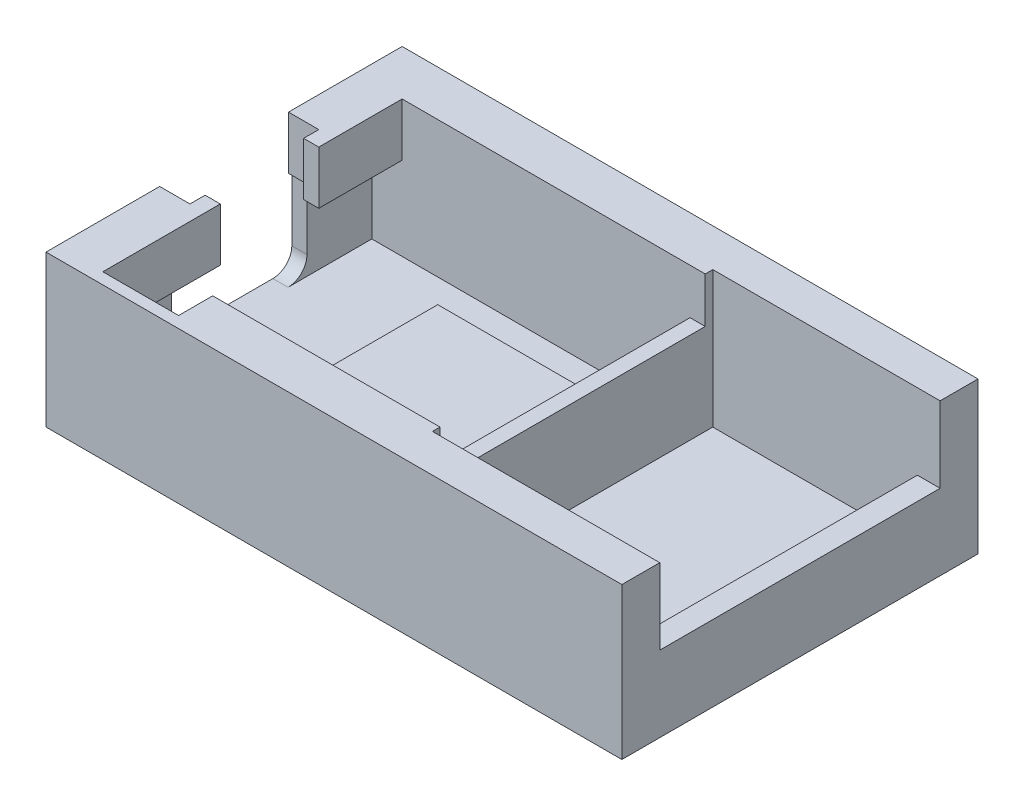
from build123d import *

# Parameters (mm, degrees)
SKETCH1_W           = 40
SKETCH1_H           = 24
BOSS_EXTRUDE1_DEPTH = 1
SKETCH2_W           = 40
SKETCH2_H           = 24
SKETCH2_W_2         = 21
SKETCH2_H_2         = 17.5
SKETCH2_W_3         = 13
SKETCH2_H_3         = 18.5
BOSS_EXTRUDE3_DEPTH = 9
SKETCH3_W           = 1
SKETCH3_H           = 17.5
CUT_EXTRUDE2_DEPTH  = 3
SKETCH4_W           = 10.24
SKETCH4_H           = 11.92
BOSS_EXTRUDE4_DEPTH = 1.21
CUT_EXTRUDE3_DEPTH  = 2
SKETCH8_W           = 4
SKETCH8_H           = 18.5
CUT_EXTRUDE4_DEPTH  = 5
SKETCH11_W          = 24
SKETCH11_H          = 10
CUT_EXTRUDE5_DEPTH  = 2
SKETCH12_W          = 4
SKETCH12_H          = 3
CUT_EXTRUDE6_DEPTH  = 3
BOSS_EXTRUDE5_DEPTH = 3.5
SKETCH14_W          = 1
SKETCH14_H          = 2.25
CUT_EXTRUDE7_DEPTH  = 3
SKETCH15_W          = 38
SKETCH15_H          = 10
CUT_EXTRUDE8_DEPTH  = 0.25
SKETCH16_W          = 38
SKETCH16_H          = 10
CUT_EXTRUDE9_DEPTH  = 0.25
SKETCH17_W          = 18.5
SKETCH17_H          = 4
CUT_EXTRUDE10_DEPTH = 0.5


with BuildPart() as part:
    # Sketch1 → Boss-Extrude1 (new body)
    with BuildSketch(Plane(origin=(0, 0, 0), x_dir=(1, 0, 0), z_dir=(0, 1, 0))):
        with Locations((20, 12)):
            Rectangle(SKETCH1_W, SKETCH1_H)
    extrude(amount=BOSS_EXTRUDE1_DEPTH)

    # Sketch2 → Boss-Extrude3 (add)
    with BuildSketch(Plane(origin=(0, 1, 0), x_dir=(1, 0, 0), z_dir=(0, 1, 0))):
        with Locations((20, 12)):
            Rectangle(SKETCH2_W, SKETCH2_H)
        with Locations((11.5, 12)):
            Rectangle(SKETCH2_W_2, SKETCH2_H_2, mode=Mode.SUBTRACT)
        with Locations((29.5, 12)):
            Rectangle(SKETCH2_W_3, SKETCH2_H_3, mode=Mode.SUBTRACT)
    extrude(amount=BOSS_EXTRUDE3_DEPTH)

    # Sketch3 → Cut-Extrude2 (cut)
    with BuildSketch(Plane(origin=(0, 10, 0), x_dir=(1, 0, 0), z_dir=(0, 1, 0))):
        with Locations((22.5, 12)):
            Rectangle(SKETCH3_W, SKETCH3_H)
    extrude(amount=-CUT_EXTRUDE2_DEPTH, mode=Mode.SUBTRACT)

    # Sketch4 → Boss-Extrude4 (add)
    with BuildSketch(Plane(origin=(0, 1, 0), x_dir=(1, 0, 0), z_dir=(0, 1, 0))):
        with Locations((13.26, 12)):
            Rectangle(SKETCH4_W, SKETCH4_H)
    extrude(amount=BOSS_EXTRUDE4_DEPTH)

    # Sketch5 → Cut-Extrude3 (cut)
    with BuildSketch(Plane(origin=(1, 0, 0), x_dir=(0, 0, -1), z_dir=(1, 0, 0))):
        with BuildLine():
            Line((7.53, 2.25), (7.53, 2.96))
            Line((7.53, 2.96), (7.53, 10))
            Line((7.53, 10), (16.47, 10))
            Line((16.47, 10), (16.47, 2.96))
            Line((16.47, 2.96), (16.47, 2.25))
            ThreePointArc((16.47, 2.25), (16.103883476, 1.366116524), (15.22, 1))
            Line((15.22, 1), (8.78, 1))
            ThreePointArc((8.78, 1), (7.896116524, 1.366116524), (7.53, 2.25))
        make_face()
    extrude(amount=-CUT_EXTRUDE3_DEPTH, mode=Mode.SUBTRACT)

    # Sketch8 → Cut-Extrude4 (cut)
    with BuildSketch(Plane(origin=(0, 10, 0), x_dir=(1, 0, 0), z_dir=(0, 1, 0))):
        with Locations((38, 12)):
            Rectangle(SKETCH8_W, SKETCH8_H)
    extrude(amount=-CUT_EXTRUDE4_DEPTH, mode=Mode.SUBTRACT)

    # Sketch11 → Cut-Extrude5 (cut)
    with BuildSketch(Plane(origin=(40, 0, 0), x_dir=(0, 0, -1), z_dir=(1, 0, 0))):
        with Locations((12, 5)):
            Rectangle(SKETCH11_W, SKETCH11_H)
    extrude(amount=-CUT_EXTRUDE5_DEPTH, mode=Mode.SUBTRACT)

    # Sketch12 → Cut-Extrude6 (cut)
    with BuildSketch(Plane(origin=(0, 10, 0), x_dir=(1, 0, 0), z_dir=(0, 1, 0))):
        with Locations((6, 2.5)):
            Rectangle(SKETCH12_W, SKETCH12_H)
    extrude(amount=-CUT_EXTRUDE6_DEPTH, mode=Mode.SUBTRACT)

    # Sketch13 → Boss-Extrude5 (add)
    with BuildSketch(Plane(origin=(0, 10, 0), x_dir=(1, 0, 0), z_dir=(0, 1, 0))):
        Polygon((1, 16.47), (1, 20.75), (3, 20.75), (3, 15.25), (2, 15.25), (2, 16.25), (0, 16.25), (0, 16.47), align=None)
        Polygon((1, 3.25), (3, 3.25), (3, 8.75), (2, 8.75), (2, 7.75), (0, 7.75), (0, 7.53), (1, 7.53), align=None)
    extrude(amount=-BOSS_EXTRUDE5_DEPTH)

    # Sketch14 → Cut-Extrude7 (cut)
    with BuildSketch(Plane(origin=(0, 10, 0), x_dir=(1, 0, 0), z_dir=(0, 1, 0))):
        with Locations((3.5, 2.125)):
            Rectangle(SKETCH14_W, SKETCH14_H)
    extrude(amount=-CUT_EXTRUDE7_DEPTH, mode=Mode.SUBTRACT)

    # Sketch15 → Cut-Extrude8 (cut)
    with BuildSketch(Plane(origin=(0, 0, -24), x_dir=(-1, 0, 0), z_dir=(0, 0, -1))):
        with Locations((-19, 5)):
            Rectangle(SKETCH15_W, SKETCH15_H)
    extrude(amount=-CUT_EXTRUDE8_DEPTH, mode=Mode.SUBTRACT)

    # Sketch16 → Cut-Extrude9 (cut)
    with BuildSketch(Plane.XY):
        with Locations((19, 5)):
            Rectangle(SKETCH16_W, SKETCH16_H)
    extrude(amount=-CUT_EXTRUDE9_DEPTH, mode=Mode.SUBTRACT)

    # Sketch17 → Cut-Extrude10 (cut)
    with BuildSketch(Plane.ZY.offset(-36)):
        with Locations((-12, 3)):
            Rectangle(SKETCH17_W, SKETCH17_H)
    extrude(amount=-CUT_EXTRUDE10_DEPTH, mode=Mode.SUBTRACT)


solid = part.part
